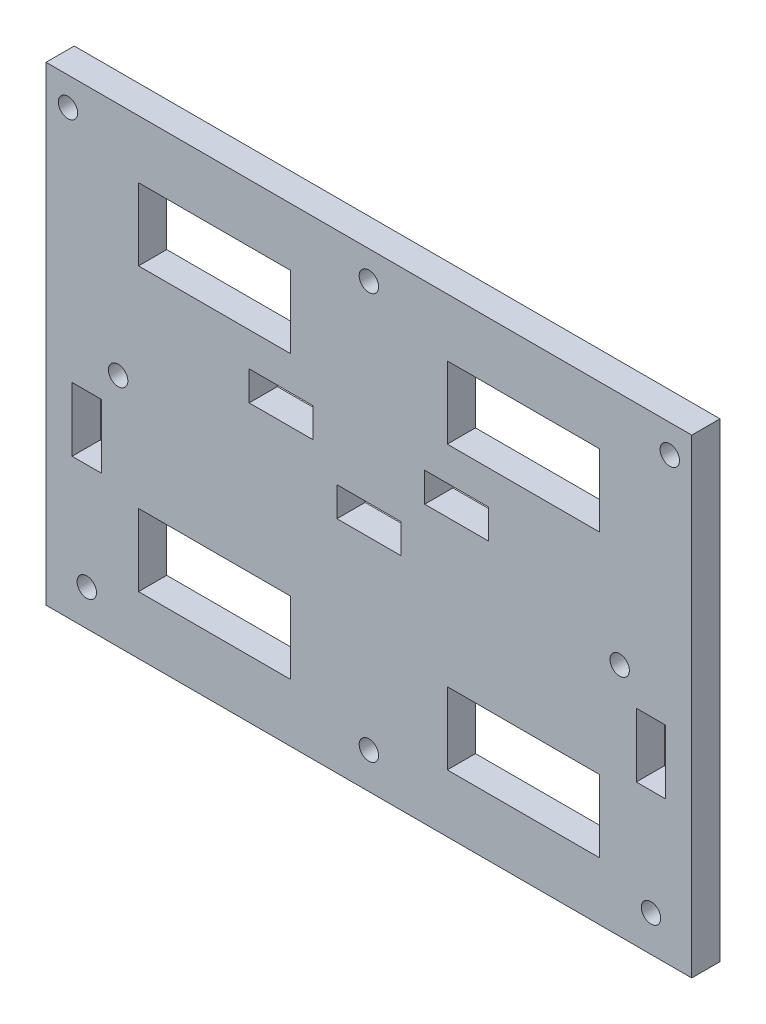
from build123d import *

# Parameters (mm, degrees)
SKETCH1_W           = 103
SKETCH1_H           = 75
SKETCH1_W_2         = 24.25
SKETCH1_H_2         = 11.5
BOSS_EXTRUDE1_DEPTH = 4.5
SKETCH2_R           = 1.55
SCREWHOLES_DEPTH    = 64.865092187
SKETCH3_W           = 10.2
SKETCH3_H           = 4.7
BELTCLAMP_DEPTH     = 64.865092187
SKETCH4_W           = 10.2
SKETCH4_H           = 4.7
CUT_EXTRUDE3_DEPTH  = 64.865092187
SKETCH5_R           = 1.55
SKETCH5_W           = 4.7
SKETCH5_H           = 10.2
CUT_EXTRUDE4_DEPTH  = 64.865092187


with BuildPart() as part:
    # Sketch1 → Boss-Extrude1 (new body)
    with BuildSketch(Plane.XY):
        Rectangle(SKETCH1_W, SKETCH1_H)
        with Locations((-24.625, 22.5)):
            Rectangle(SKETCH1_W_2, SKETCH1_H_2, mode=Mode.SUBTRACT)
        with Locations((24.625, 22.5)):
            Rectangle(SKETCH1_W_2, SKETCH1_H_2, mode=Mode.SUBTRACT)
        with Locations((24.625, -22.5)):
            Rectangle(SKETCH1_W_2, SKETCH1_H_2, mode=Mode.SUBTRACT)
        with Locations((-24.625, -22.5)):
            Rectangle(SKETCH1_W_2, SKETCH1_H_2, mode=Mode.SUBTRACT)
    extrude(amount=BOSS_EXTRUDE1_DEPTH)

    # Sketch2 → screwHoles (cut, through all)
    with BuildSketch(Plane.XY.offset(4.5)):
        with Locations((-48, 33)):
            Circle(SKETCH2_R)
        with Locations(Location((48, 33, 0), (0, 0, 180))):
            Circle(SKETCH2_R)
        with Locations((40, 0)):
            Circle(SKETCH2_R)
        with Locations(Location((-40, 0, 0), (0, 0, 180))):
            Circle(SKETCH2_R)
        with Locations((0, 33)):
            Circle(SKETCH2_R)
    extrude(amount=-SCREWHOLES_DEPTH, mode=Mode.SUBTRACT)

    # Sketch3 → BeltClamp (cut, through all)
    with BuildSketch(Plane.XY.offset(4.5)):
        with Locations((-14, 9)):
            Rectangle(SKETCH3_W, SKETCH3_H)
        with Locations((14, 9)):
            Rectangle(SKETCH3_W, SKETCH3_H)
    extrude(amount=-BELTCLAMP_DEPTH, mode=Mode.SUBTRACT)

    # Sketch4 → Cut-Extrude3 (cut, through all)
    with BuildSketch(Plane.XY.offset(4.5)):
        Rectangle(SKETCH4_W, SKETCH4_H)
    extrude(amount=-CUT_EXTRUDE3_DEPTH, mode=Mode.SUBTRACT)

    # Sketch5 → Cut-Extrude4 (cut, through all)
    with BuildSketch(Plane.XY.offset(4.5)):
        with Locations((45, -31.75)):
            Circle(SKETCH5_R)
        with Locations(Location((-45, -31.75, 0), (0, 0, 180))):
            Circle(SKETCH5_R)
        with Locations((0, -31.75)):
            Circle(SKETCH5_R)
        with Locations((45, -9.75)):
            Rectangle(SKETCH5_W, SKETCH5_H)
        with Locations((-45, -9.75)):
            Rectangle(SKETCH5_W, SKETCH5_H)
    extrude(amount=-CUT_EXTRUDE4_DEPTH, mode=Mode.SUBTRACT)


solid = part.part
